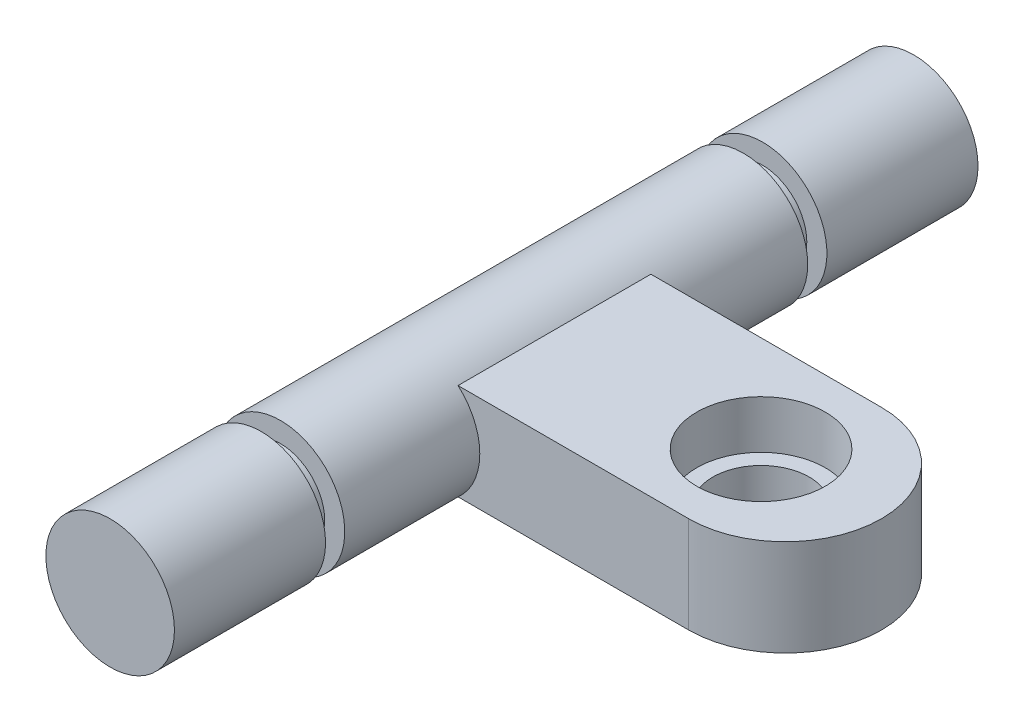
from build123d import *

# Parameters (mm, degrees)
SKETCH3_R           = 3
BOSS_EXTRUDE1_DEPTH = 3
SKETCH4_R           = 4
CUT_EXTRUDE1_DEPTH  = 3
SKETCH6_R           = 4
BOSS_EXTRUDE2_DEPTH = 25
SKETCH7_W           = 2.5
SKETCH7_H           = 1.19510496


with BuildPart() as part:
    # Sketch3 → Boss-Extrude1 (new, symmetric)
    with BuildSketch(Plane(origin=(0, 0, 0), x_dir=(1, 0, 0), z_dir=(0, 1, 0))):
        with BuildLine():
            Line((8.5, -6), (-8.5, -6))
            Line((-8.5, -6), (-8.5, 6))
            Line((-8.5, 6), (8.5, 6))
            ThreePointArc((8.5, 6), (14.5, 0), (8.5, -6))
        make_face()
        with Locations(Location((7, 0, 0), (0, 0, 270))):
            Circle(SKETCH3_R, mode=Mode.SUBTRACT)
    extrude(amount=BOSS_EXTRUDE1_DEPTH, both=True)

    # Sketch4 → Cut-Extrude1 (cut)
    with BuildSketch(Plane(origin=(0, 3, 0), x_dir=(1, 0, 0), z_dir=(0, 1, 0))):
        with Locations(Location((7, 0, 0), (0, 0, 270))):
            Circle(SKETCH4_R)
    extrude(amount=-CUT_EXTRUDE1_DEPTH, mode=Mode.SUBTRACT)

    # Sketch6 → Boss-Extrude2 (add, symmetric)
    with BuildSketch(Plane.XY):
        with Locations((-8.5, 0)):
            Circle(SKETCH6_R)
    extrude(amount=BOSS_EXTRUDE2_DEPTH, both=True)

    # Sketch7 → Cut-Revolve1 (revolve, cut)
    with BuildSketch(Plane(origin=(0, 0, 0), x_dir=(1, 0, 0), z_dir=(0, 1, 0))):
        with Locations((-4.5, 15)):
            Rectangle(SKETCH7_W, SKETCH7_H)
        with Locations((-4.5, -15)):
            Rectangle(SKETCH7_W, SKETCH7_H)
    revolve(axis=Axis((-8.5, 0, 25), (0, 0, -1)), mode=Mode.SUBTRACT)


solid = part.part
